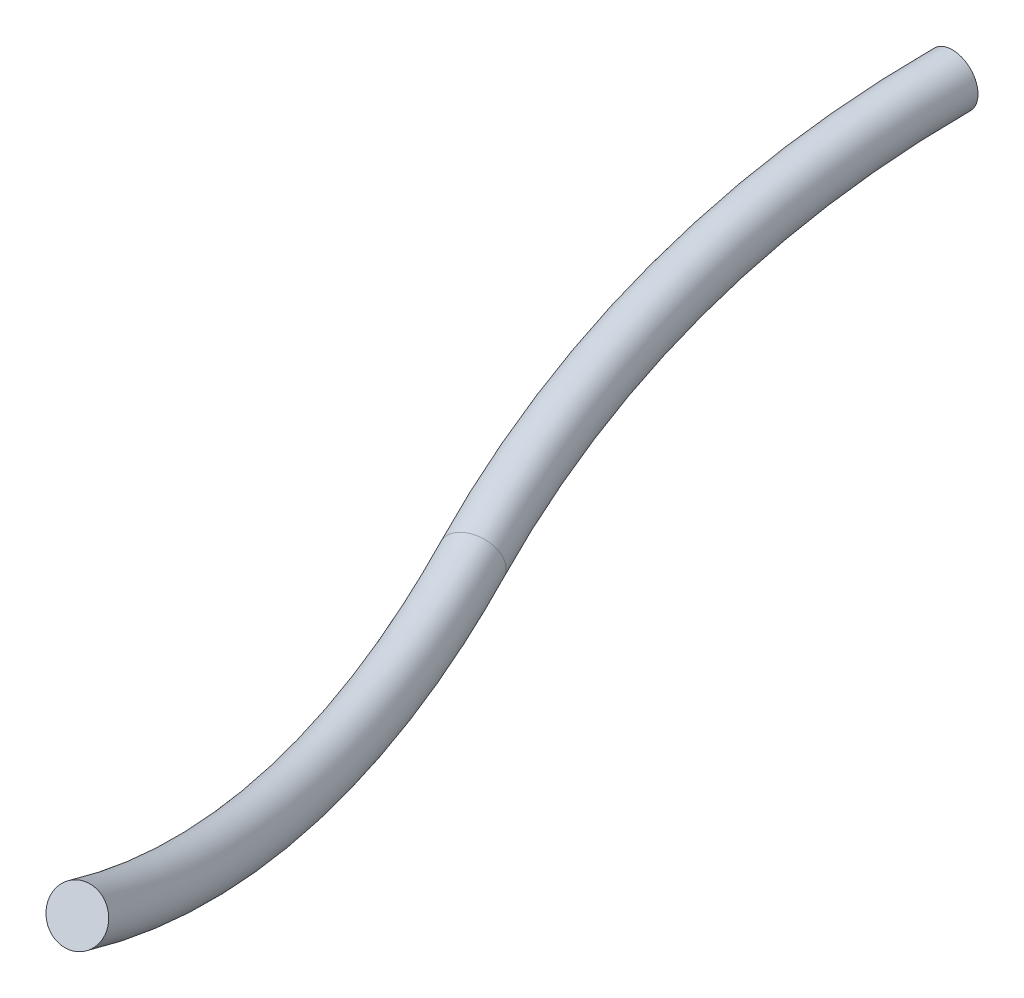
from build123d import *

# Parameters (mm, degrees)
SKETCH2_R = 50.8
SKETCH6_R = 50.799999993


with BuildPart() as part:
    # Sweep1: sweep along a path in Sketch4
    with BuildLine(Plane(origin=(-5131.078989002, -10122.186559946, 0), x_dir=(-0.8723137904079419, 0.44218815127260264, 0.20865830905633093), z_dir=(0.45214039237946024, 0.8919467840510149, -2.4980018054066026e-15))) as sweep1_path:
        ThreePointArc((-7253.727344917, 1547.615662957), (-7191.520486771, 2152.84762497), (-7260.209908177, 2757.378173768))
    # Sketch2 → Sweep1 (sweep)
    with BuildSketch(Plane(origin=(0, 0, 0), x_dir=(0.9602829596363347, -0.27902802266453763, 0), z_dir=(0, 0, 1))):
        with Locations((5185.617777687, -12526.27938552)):
            Circle(SKETCH2_R)
    sweep(path=sweep1_path.line)

    # Sweep2: sweep along a path in Sketch5
    with BuildLine(Plane(origin=(-2332.400973727, -709.400009665, 809.395257887), x_dir=(0.18612085311145735, 0.4079085380510345, 0.8938510237294195), z_dir=(-0.9079915551182666, -0.2761657301776024, 0.3150933596719927))) as sweep2_path:
        ThreePointArc((-4168.993629656, -12849.958887333), (-3630.278729459, -13129.879958055), (-3031.449360081, -13229.744545863))
    # Sketch6 → Sweep2 (sweep)
    with BuildSketch(Plane(origin=(1595.787154509, -808.926993286, 3889.52451291), x_dir=(0.81381322376985, 0.5369624706508986, -0.22221463032349403), z_dir=(0.37273658307556184, -0.18894542582523022, 0.9084971467742082))):
        with Locations((-6165.460608587, -11522.074885808)):
            Circle(SKETCH6_R)
    sweep(path=sweep2_path.line)


solid = part.part
